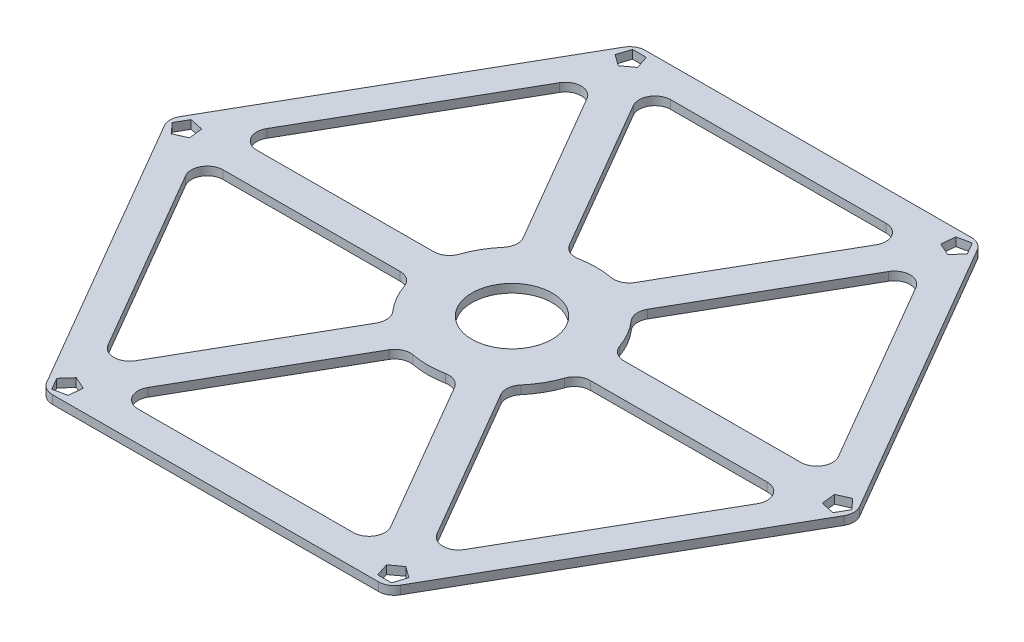
from build123d import *

# Parameters (mm, degrees)
BOSS_EXTRUDE1_DEPTH = 1.6
FILLET1_R           = 3
FILLET2_R           = 3
SKETCH3_R           = 7.6
CUT_EXTRUDE1_DEPTH  = 10
SCALE1_SCALE        = 1.15


with BuildPart() as part:
    # Sketch1 → Boss-Extrude1 (new body)
    with BuildSketch(Plane(origin=(0, 0, 0), x_dir=(1, 0, 0), z_dir=(0, 1, 0))):
        Polygon((-32.670459977, 56.192891409), (-64.999701461, -0.197002589), (-32.329241484, -56.389893998), (32.670459977, -56.192891409), (64.999701461, 0.197002589), (32.329241484, 56.389893998), align=None)
        with BuildLine():
            Line((-31.193440085, 47.277250649), (-56.559443422, 3.032901767))
            Line((-56.559443422, 3.032901767), (-15.685493875, 3.156783473))
            ThreePointArc((-15.685493875, 3.156783473), (-13.880589292, 7.957967134), (-10.649180608, 11.941312842))
            Line((-10.649180608, 11.941312842), (-31.193440085, 47.277250649))
        make_face(mode=Mode.SUBTRACT)
        with BuildLine():
            Line((-56.540020126, -3.375686221), (-30.906291689, -47.465463944))
            Line((-30.906291689, -47.465463944), (-10.576601619, -12.00564443))
            ThreePointArc((-10.576601619, -12.00564443), (-13.832096347, -8.041959379), (-15.666070579, -3.251804515))
            Line((-15.666070579, -3.251804515), (-56.540020126, -3.375686221))
        make_face(mode=Mode.SUBTRACT)
        with BuildLine():
            Line((-25.346580041, -50.65293687), (25.653151733, -50.498365711))
            Line((25.653151733, -50.498365711), (5.108892256, -15.162427903))
            ThreePointArc((5.108892256, -15.162427903), (0.048492945, -15.999926513), (-5.016889971, -15.193117357))
            Line((-5.016889971, -15.193117357), (-25.346580041, -50.65293687))
        make_face(mode=Mode.SUBTRACT)
        with BuildLine():
            Line((31.193440085, -47.277250649), (56.559443422, -3.032901767))
            Line((56.559443422, -3.032901767), (15.685493875, -3.156783473))
            ThreePointArc((15.685493875, -3.156783473), (13.880589292, -7.957967134), (10.649180608, -11.941312842))
            Line((10.649180608, -11.941312842), (31.193440085, -47.277250649))
        make_face(mode=Mode.SUBTRACT)
        with BuildLine():
            Line((56.540020126, 3.375686221), (30.906291689, 47.465463944))
            Line((30.906291689, 47.465463944), (10.576601619, 12.00564443))
            ThreePointArc((10.576601619, 12.00564443), (13.832096347, 8.041959379), (15.666070579, 3.251804515))
            Line((15.666070579, 3.251804515), (56.540020126, 3.375686221))
        make_face(mode=Mode.SUBTRACT)
        with BuildLine():
            Line((25.346580041, 50.65293687), (-25.653151733, 50.498365711))
            Line((-25.653151733, 50.498365711), (-5.108892256, 15.162427903))
            ThreePointArc((-5.108892256, 15.162427903), (-0.048492945, 15.999926513), (5.016889971, 15.193117357))
            Line((5.016889971, 15.193117357), (25.346580041, 50.65293687))
        make_face(mode=Mode.SUBTRACT)
        Polygon((28.764451985, 52.408726504), (31.157091964, 51.352131998), (32.90133947, 53.301162184), (31.586703733, 55.562323589), (29.029966659, 55.010768007), align=None, mode=Mode.SUBTRACT)
        Polygon((-31.00506254, 51.115109397), (-28.893704867, 52.658899148), (-29.709490768, 55.143976891), (-32.325031855, 55.136049649), (-33.125739246, 52.646072601), align=None, mode=Mode.SUBTRACT)
        Polygon((59.769514525, 1.293617108), (60.050796831, -1.30676715), (62.610830237, -1.842814707), (63.911735588, 0.42627394), (62.155705905, 2.364695405), align=None, mode=Mode.SUBTRACT)
        Polygon((31.00506254, -51.115109397), (28.893704867, -52.658899148), (29.709490768, -55.143976891), (32.325031855, -55.136049649), (33.125739246, -52.646072601), align=None, mode=Mode.SUBTRACT)
        Polygon((-28.764451985, -52.408726504), (-31.157091964, -51.352131998), (-32.90133947, -53.301162184), (-31.586703733, -55.562323589), (-29.029966659, -55.010768007), align=None, mode=Mode.SUBTRACT)
        Polygon((-59.769514525, -1.293617108), (-60.050796831, 1.30676715), (-62.610830237, 1.842814707), (-63.911735588, -0.42627394), (-62.155705905, -2.364695405), align=None, mode=Mode.SUBTRACT)
    extrude(amount=BOSS_EXTRUDE1_DEPTH)

    # Fillet1
    fillet1_edges = [part.edges().sort_by_distance(p)[0] for p in [
        (32.329241484, 0.8, -56.389893998),
        (64.999701461, 0.8, -0.197002589),
        (32.670459977, 0.8, 56.192891409),
        (-32.329241484, 0.8, 56.389893998),
        (-64.999701461, 0.8, 0.197002589),
        (-32.670459977, 0.8, -56.192891409),
    ]]
    fillet(fillet1_edges, radius=FILLET1_R)

    # Fillet2
    fillet2_edges = [part.edges().sort_by_distance(p)[0] for p in [
        (-25.653151733, 0.8, -50.498365711),
        (-5.108892256, 0.8, -15.162427903),
        (5.016889971, 0.8, -15.193117357),
        (25.346580041, 0.8, -50.65293687),
        (30.906291689, 0.8, -47.465463944),
        (10.576601619, 0.8, -12.00564443),
        (15.666070579, 0.8, -3.251804515),
        (56.540020126, 0.8, -3.375686221),
        (56.559443422, 0.8, 3.032901767),
        (15.685493875, 0.8, 3.156783473),
        (10.649180608, 0.8, 11.941312842),
        (31.193440085, 0.8, 47.277250649),
        (25.653151733, 0.8, 50.498365711),
        (5.108892256, 0.8, 15.162427903),
        (-5.016889971, 0.8, 15.193117357),
        (-25.346580041, 0.8, 50.65293687),
        (-30.906291689, 0.8, 47.465463944),
        (-10.576601619, 0.8, 12.00564443),
        (-15.666070579, 0.8, 3.251804515),
        (-56.540020126, 0.8, 3.375686221),
        (-10.649180608, 0.8, -11.941312842),
        (-31.193440085, 0.8, -47.277250649),
        (-56.559443422, 0.8, -3.032901767),
        (-15.685493875, 0.8, -3.156783473),
    ]]
    fillet(fillet2_edges, radius=FILLET2_R)

    # Sketch3 → Cut-Extrude1 (cut)
    with BuildSketch(Plane(origin=(0, 3.6, 0), x_dir=(1, 0, 0), z_dir=(0, 1, 0))):
        with Locations(Location((0, 0, 0), (0, 0, 270))):
            Circle(SKETCH3_R)
    extrude(amount=-CUT_EXTRUDE1_DEPTH, mode=Mode.SUBTRACT)


with BuildPart() as part_1:
    # Scale1: scaled about (0, 0.8, 0)
    add(part.part.scale(SCALE1_SCALE).moved(Location((0, -0.12, 0))))


solid = part_1.part
